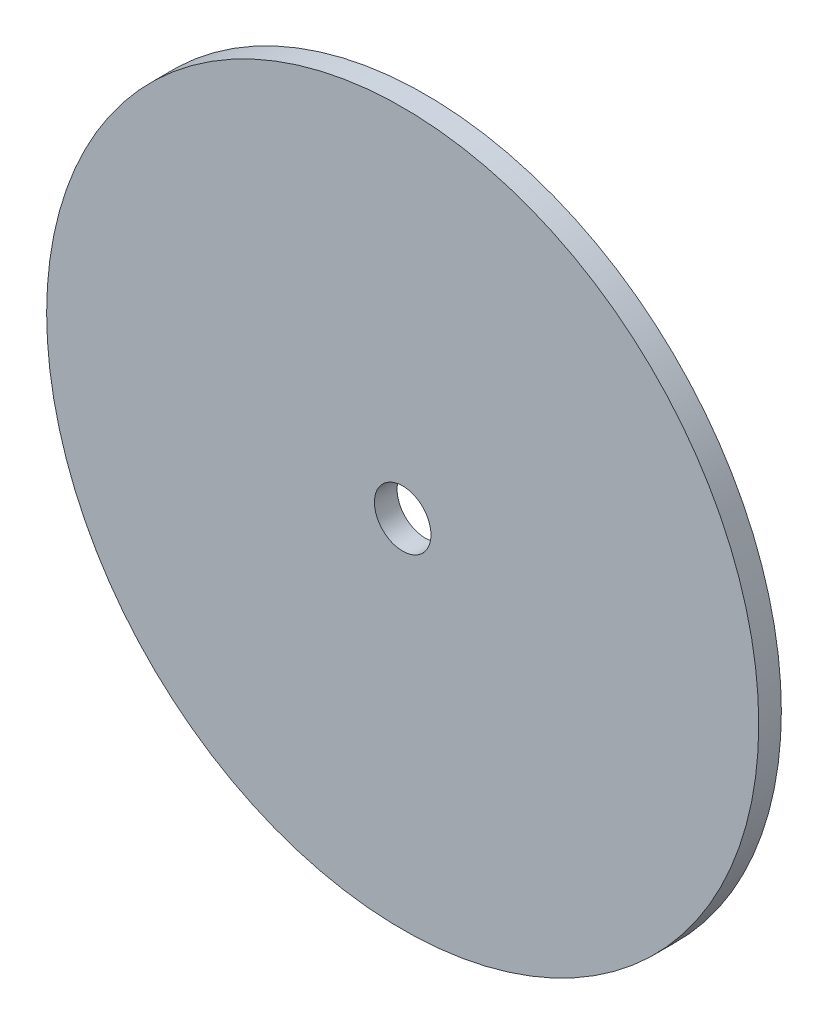
from build123d import *

# Parameters (mm, degrees)
SKETCH1_R           = 100
SKETCH1_R_2         = 7.9375
BOSS_EXTRUDE1_DEPTH = 6.35


with BuildPart() as part:
    # Sketch1 → Boss-Extrude1 (new body)
    with BuildSketch(Plane.XY):
        Circle(SKETCH1_R)
        Circle(SKETCH1_R_2, mode=Mode.SUBTRACT)
    extrude(amount=BOSS_EXTRUDE1_DEPTH)


solid = part.part
